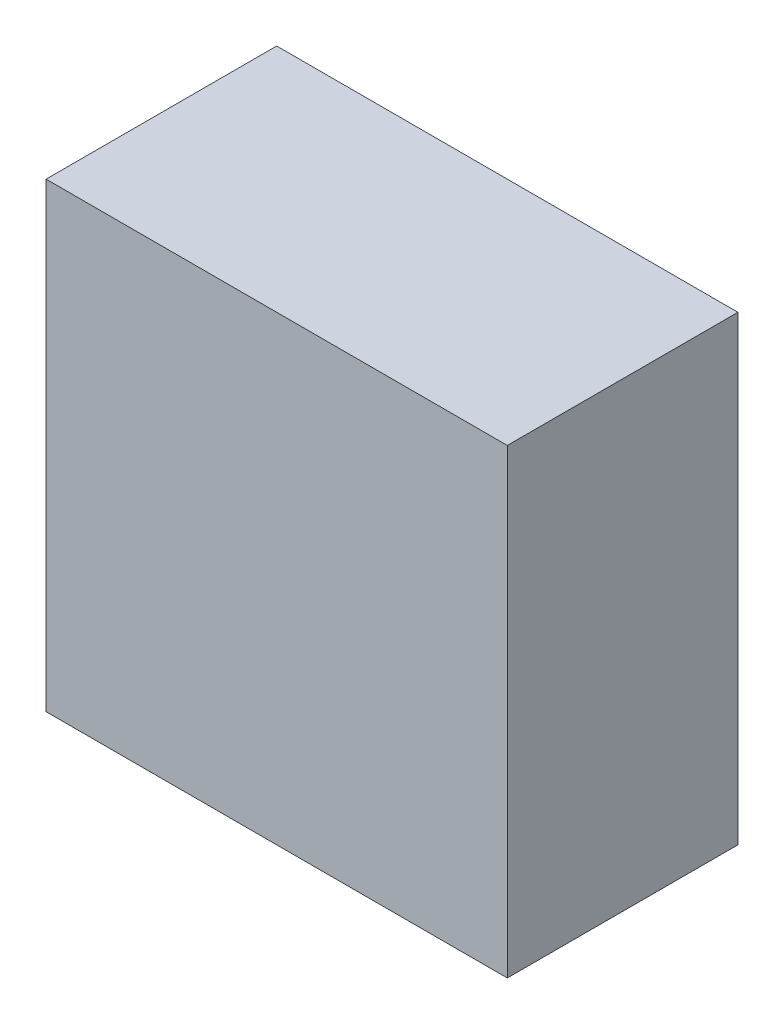
from build123d import *

# Parameters (mm, degrees)
SKETCH1_W           = 20
SKETCH1_H           = 20
BOSS_EXTRUDE1_DEPTH = 10


with BuildPart() as part:
    # Sketch1 → Boss-Extrude1 (new body)
    with BuildSketch(Plane.XY):
        with Locations((10, 10)):
            Rectangle(SKETCH1_W, SKETCH1_H)
    extrude(amount=BOSS_EXTRUDE1_DEPTH)


solid = part.part
